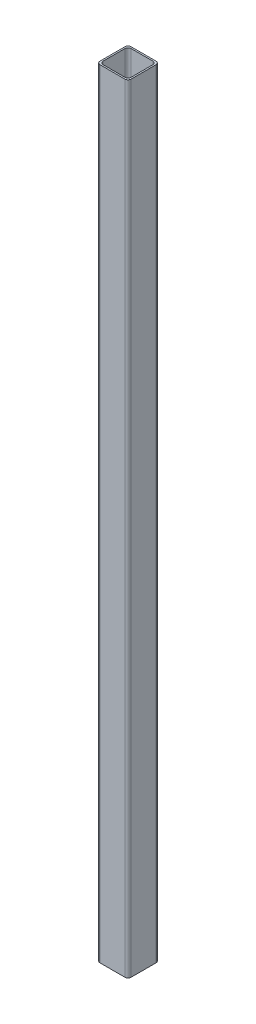
from build123d import *

# Parameters (mm, degrees)
BOSS_EXTRUDE1_DEPTH = 500


with BuildPart() as part:
    # Sketch1 → Boss-Extrude1 (new, symmetric)
    with BuildSketch(Plane(origin=(0, 0, 0), x_dir=(1, 0, 0), z_dir=(0, 1, 0))):
        with BuildLine():
            Line((-16, -20), (16, -20))
            ThreePointArc((16, -20), (18.828427125, -18.828427125), (20, -16))
            Line((20, -16), (20, 16))
            ThreePointArc((20, 16), (18.828427125, 18.828427125), (16, 20))
            Line((16, 20), (-16, 20))
            ThreePointArc((-16, 20), (-18.828427125, 18.828427125), (-20, 16))
            Line((-20, 16), (-20, -16))
            ThreePointArc((-20, -16), (-18.828427125, -18.828427125), (-16, -20))
        make_face()
        with BuildLine():
            Line((-14, -18), (14, -18))
            ThreePointArc((14, -18), (16.828427125, -16.828427125), (18, -14))
            Line((18, -14), (18, 14))
            ThreePointArc((18, 14), (16.828427125, 16.828427125), (14, 18))
            Line((14, 18), (-14, 18))
            ThreePointArc((-14, 18), (-16.828427125, 16.828427125), (-18, 14))
            Line((-18, 14), (-18, -14))
            ThreePointArc((-18, -14), (-16.828427125, -16.828427125), (-14, -18))
        make_face(mode=Mode.SUBTRACT)
    extrude(amount=BOSS_EXTRUDE1_DEPTH, both=True)


solid = part.part
